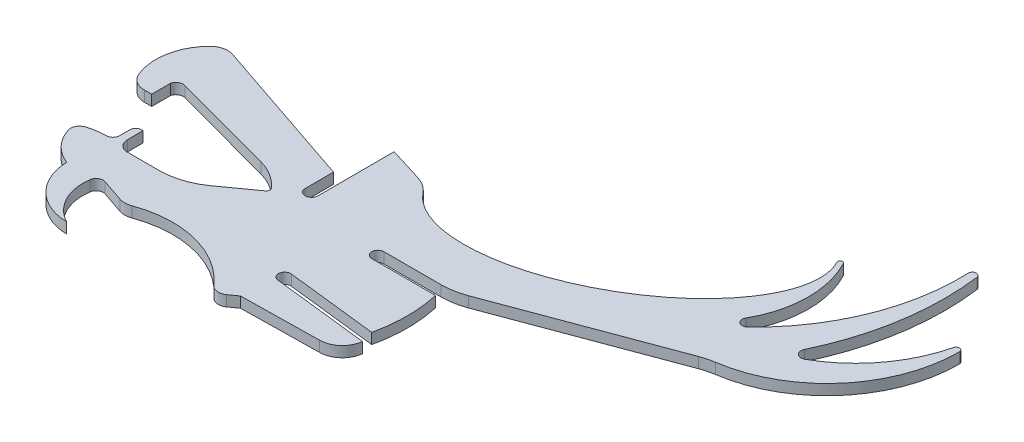
from build123d import *

# Parameters (mm, degrees)
BOSS_EXTRUDE2_DEPTH = 3
FILLET1_R           = 10


with BuildPart() as part:
    # Sketch1 → Boss-Extrude2 (new body)
    with BuildSketch(Plane(origin=(0, 0, 0), x_dir=(1, 0, 0), z_dir=(0, 1, 0))):
        with BuildLine():
            Line((83.277636848, 6.577391731), (36.063202158, -10.996818305))
            ThreePointArc((36.063202158, -10.996818305), (32.802532832, -11.889585683), (29.435258028, -12.19034879))
            Line((29.435258028, -12.19034879), (13.331621464, -12.19034879))
            ThreePointArc((13.331621464, -12.19034879), (11.631621464, -13.89034879), (13.331621464, -15.59034879))
            Line((13.331621464, -15.59034879), (31.335553361, -15.59034879))
            ThreePointArc((31.335553361, -15.59034879), (32.329091164, -24.600925987), (31.335553361, -33.611503185))
            Line((31.335553361, -33.611503185), (5.718159441, -30.692769825))
            ThreePointArc((5.718159441, -30.692769825), (3.836641823, -32.189396516), (5.333268515, -34.070914135))
            Line((5.333268515, -34.070914135), (32.258758745, -37.138686243))
            ThreePointArc((32.258758745, -37.138686243), (30.141236011, -41.228168064), (25.83833159, -42.869136571))
            Line((25.83833159, -42.869136571), (3.931607644, -43.234741077))
            Line((3.931607644, -43.234741077), (1.645004408, -44.879459267))
            ThreePointArc((1.645004408, -44.879459267), (-0.44755249, -45.424610965), (-2.363050322, -44.421190413))
            ThreePointArc((-2.363050322, -44.421190413), (-16.657617756, -35.649988568), (-33.406545395, -36.511419261))
            ThreePointArc((-33.406545395, -36.511419261), (-35.065515769, -36.818007167), (-36.732015424, -36.555409102))
            Line((-36.732015424, -36.555409102), (-43.072013441, -34.41346595))
            ThreePointArc((-43.072013441, -34.41346595), (-44.756883472, -34.602804193), (-45.690953078, -36.017777677))
            ThreePointArc((-45.690953078, -36.017777677), (-44.377060251, -43.944176391), (-38.701961301, -49.631650596))
            ThreePointArc((-38.701961301, -49.631650596), (-48.89375638, -45.294039559), (-53.199015105, -35.088535957))
            ThreePointArc((-53.199015105, -35.088535957), (-57.963880411, -31.924307539), (-60.880420097, -27.003933658))
            ThreePointArc((-60.880420097, -27.003933658), (-60.719986784, -25.061085947), (-59.232742508, -23.80072864))
            ThreePointArc((-59.232742508, -23.80072864), (-56.720776297, -23.205324241), (-54.14697512, -23.005253893))
            ThreePointArc((-54.14697512, -23.005253893), (-52.817288904, -22.454479829), (-52.26651484, -21.124793613))
            Line((-52.26651484, -21.124793613), (-52.26651484, -18.255253893))
            ThreePointArc((-52.26651484, -18.255253893), (-51.768596368, -17.053172365), (-50.56651484, -16.555253893))
            Line((-50.56651484, -16.555253893), (-50.18504008, -16.555253893))
            Line((-50.18504008, -16.555253893), (-50.18504008, -21.008976099))
            ThreePointArc((-50.18504008, -21.008976099), (-49.292805972, -23.163019785), (-47.138762286, -24.055253893))
            Line((-47.138762286, -24.055253893), (-38.258057554, -24.055253893))
            ThreePointArc((-38.258057554, -24.055253893), (-32.429820226, -23.139270307), (-27.163537606, -20.479638066))
            Line((-27.163537606, -20.479638066), (-18.213895237, -14.042299326))
            ThreePointArc((-18.213895237, -14.042299326), (-17.803794916, -13.348327859), (-18.036830501, -12.576658832))
            ThreePointArc((-18.036830501, -12.576658832), (-21.621060958, -9.471725354), (-25.963310125, -7.565894288))
            Line((-25.963310125, -7.565894288), (-55.30954126, 0.349304832))
            ThreePointArc((-55.30954126, 0.349304832), (-56.903028243, 0.142191478), (-57.883342437, -1.131025232))
            Line((-57.883342437, -1.131025232), (-57.883342437, -6.467193959))
            Line((-57.883342437, -6.467193959), (-59.970418868, -6.467193959))
            ThreePointArc((-59.970418868, -6.467193959), (-62.745333472, -5.626502668), (-64.58710946, -3.387133535))
            ThreePointArc((-64.58710946, -3.387133535), (-65.510981808, 5.487804074), (-61.413967112, 13.414501258))
            ThreePointArc((-61.413967112, 13.414501258), (-58.998069827, 14.801189981), (-56.215124926, 14.680016601))
            Line((-56.215124926, 14.680016601), (-13.213967112, 0.152246204))
            Line((-13.213967112, 0.152246204), (-13.195522989, -7.843254171))
            ThreePointArc((-13.195522989, -7.843254171), (-11.391375526, -9.63909713), (-9.595532567, -7.834949667))
            Line((-9.595532567, -7.834949667), (-9.645178165, 13.686344484))
            Line((-9.645178165, 13.686344484), (3.240530108, 9.701083124))
            add(Edge.make_bspline(
                [(3.240530108, 9.701083124), (13.894797432, -10.964082924), (52.167573777, 8.768078407), (90.440350123, 28.500239738), (79.7860828, 49.165405786)],
                knots=[0, 0, 0, 1.570796327, 1.570796327, 3.141592654, 3.141592654, 3.141592654], degree=2, weights=[1, 0.707106781, 1, 0.707106781, 1]))
            ThreePointArc((79.7860828, 49.165405786), (80.072864648, 50.071466121), (80.980537261, 49.789828788))
            ThreePointArc((80.980537261, 49.789828788), (84.258913327, 36.167877688), (80.573020022, 22.650500281))
            ThreePointArc((80.573020022, 22.650500281), (80.977131886, 20.603840239), (83.060820169, 20.705658035))
            ThreePointArc((83.060820169, 20.705658035), (96.799731472, 40.905147255), (100.995247842, 64.971195766))
            ThreePointArc((100.995247842, 64.971195766), (102.023911204, 66.136579392), (103.234366802, 65.161354006))
            ThreePointArc((103.234366802, 65.161354006), (102.922479327, 43.72601882), (96.524889391, 23.265282974))
            ThreePointArc((96.524889391, 23.265282974), (96.918331366, 21.170533694), (99.034577715, 20.917013432))
            ThreePointArc((99.034577715, 20.917013432), (110.533106389, 30.95950626), (117.098161764, 44.742389549))
            ThreePointArc((117.098161764, 44.742389549), (118.133339849, 45.458434414), (118.968319872, 44.516562727))
            ThreePointArc((118.968319872, 44.516562727), (109.903683893, 20.121141501), (87.108506166, 7.563909538))
            ThreePointArc((87.108506166, 7.563909538), (85.167327095, 7.170621945), (83.277636848, 6.577391731))
        make_face()
    extrude(amount=BOSS_EXTRUDE2_DEPTH)

    # Fillet1
    fillet1_edges = [part.edges().sort_by_distance(p)[0] for p in [
        (3.240530108, 1.5, -9.701083124),
    ]]
    fillet(fillet1_edges, radius=FILLET1_R)


solid = part.part
